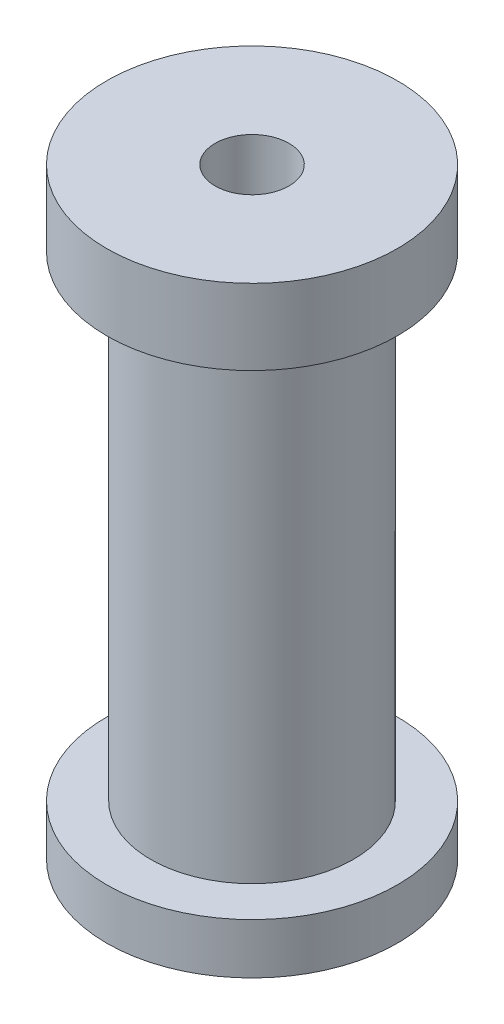
from build123d import *

# Parameters (mm, degrees)
SKETCH1_R           = 13.4366
BOSS_EXTRUDE1_DEPTH = 4.6736
SKETCH2_R           = 9.3726
BOSS_EXTRUDE2_DEPTH = 43.942
SKETCH3_R           = 13.4366
BOSS_EXTRUDE3_DEPTH = 6.985
SKETCH4_R           = 3.4163
CUT_EXTRUDE1_DEPTH  = 59.758073143


with BuildPart() as part:
    # Sketch1 → Boss-Extrude1 (new body)
    with BuildSketch(Plane(origin=(0, 0, 0), x_dir=(1, 0, 0), z_dir=(0, 1, 0))):
        with Locations(Location((0, 0, 0), (0, 0, 270))):
            Circle(SKETCH1_R)
    extrude(amount=BOSS_EXTRUDE1_DEPTH)

    # Sketch2 → Boss-Extrude2 (add)
    with BuildSketch(Plane(origin=(0, 4.6736, 0), x_dir=(1, 0, 0), z_dir=(0, 1, 0))):
        with Locations(Location((0, 0, 0), (0, 0, 90))):
            Circle(SKETCH2_R)
    extrude(amount=BOSS_EXTRUDE2_DEPTH)

    # Sketch3 → Boss-Extrude3 (add)
    with BuildSketch(Plane(origin=(0, 48.6156, 0), x_dir=(1, 0, 0), z_dir=(0, 1, 0))):
        with Locations(Location((0, 0, 0), (0, 0, 270))):
            Circle(SKETCH3_R)
    extrude(amount=BOSS_EXTRUDE3_DEPTH)

    # Sketch4 → Cut-Extrude1 (cut, through all)
    with BuildSketch(Plane.XZ):
        with Locations(Location((0, 0, 0), (0, 0, 270))):
            Circle(SKETCH4_R)
    extrude(amount=-CUT_EXTRUDE1_DEPTH, mode=Mode.SUBTRACT)


solid = part.part
